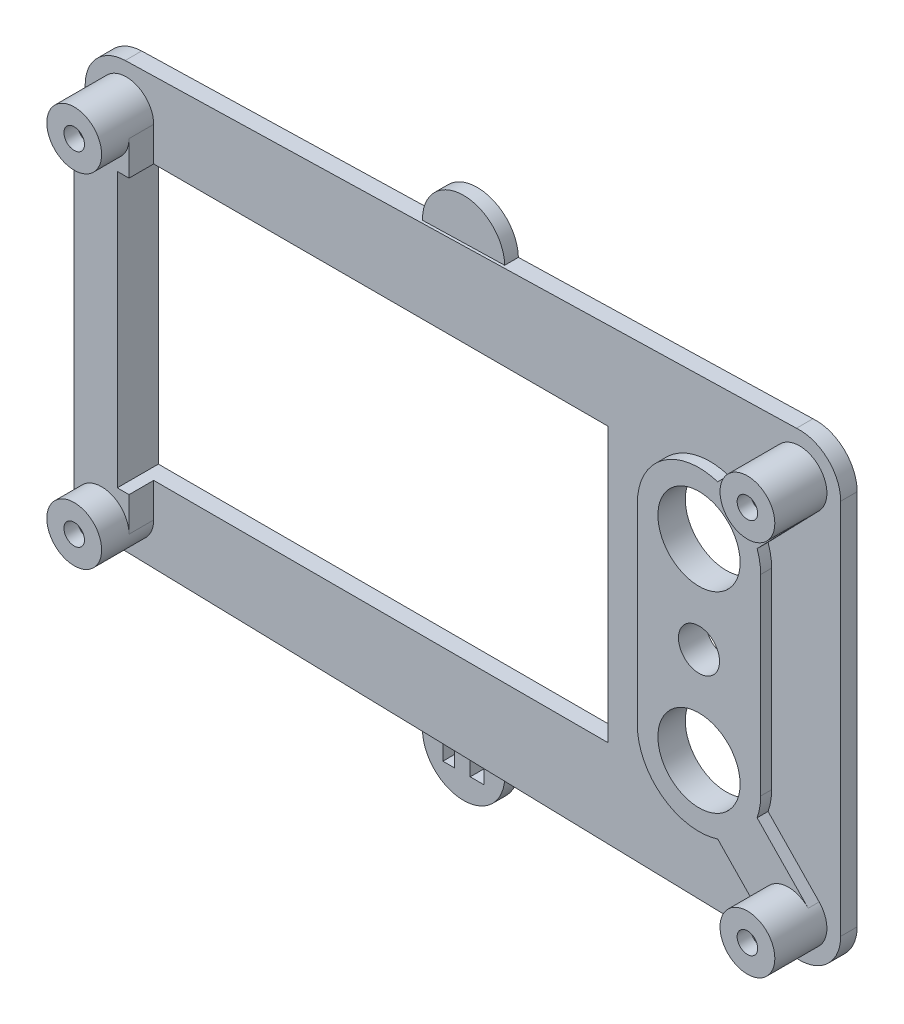
from build123d import *

# Parameters (mm, degrees)
EXTRUDE_1_DEPTH     = 1.2
SKETCH_2_8_R        = 1.5
EXTRUDE_7_DEPTH     = 2
SKETCH_2_9_R        = 1.5
EXTRUDE_8_DEPTH     = 5
SKETCH_2_10_R       = 1.5
EXTRUDE_9_DEPTH     = 5
SKETCH_2_11_R       = 1.5
EXTRUDE_10_DEPTH    = 5
SKETCH_2_12_R       = 1.5
EXTRUDE_11_DEPTH    = 5
SKETCH_2_13_R       = 1.5
SKETCH_2_13_R_2     = 0.75
EXTRUDE_12_DEPTH    = 5
SKETCH_2_14_R       = 1.5
SKETCH_2_14_R_2     = 0.75
EXTRUDE_13_DEPTH    = 5
SKETCH_2_15_R       = 1.5
SKETCH_2_15_R_2     = 0.75
EXTRUDE_14_DEPTH    = 5
SKETCH_2_16_R       = 1.5
SKETCH_2_16_R_2     = 0.75
EXTRUDE_15_DEPTH    = 5
SKETCH_2_19_R       = 1.5
SKETCH_2_19_R_2     = 0.75
CUT_EXTRUDE_4_DEPTH = 4
SKETCH_2_20_R       = 1.5
SKETCH_2_20_R_2     = 0.75
CUT_EXTRUDE_5_DEPTH = 4
SKETCH_2_21_R       = 1.5
SKETCH_2_21_R_2     = 0.75
CUT_EXTRUDE_6_DEPTH = 4
SKETCH_2_22_R       = 1.5
SKETCH_2_22_R_2     = 0.75
CUT_EXTRUDE_7_DEPTH = 4
EXTRUDE_16_DEPTH    = 3
EXTRUDE_18_DEPTH    = 2
EXTRUDE_19_DEPTH    = 1
SKETCH_5_W          = 0.85413001
SKETCH_5_H          = 2.598019217
SKETCH_5_W_2        = 1.005417368
SKETCH_5_H_2        = 2.475260341
CUT_EXTRUDE_9_DEPTH = 1


with BuildPart() as part:
    # 草图2 → 凸台-拉伸1 (new body)
    with BuildSketch(Plane.XY):
        with BuildLine():
            Line((-0.220057138, 2.999023685), (-49.204110666, 1.749023685))
            ThreePointArc((-49.204110666, 1.749023685), (-51.275787659, 0.844087888), (-52.127580054, -1.25))
            Line((-52.127580054, -1.25), (-52.127580054, -26.25))
            ThreePointArc((-52.127580054, -26.25), (-51.275787659, -28.344087888), (-49.204110666, -29.249023685))
            Line((-49.204110666, -29.249023685), (-0.220057138, -30.499023685))
            ThreePointArc((-0.220057138, -30.499023685), (2.04705122, -29.702759522), (3.007086332, -27.5))
            Line((3.007086332, -27.5), (3.007086332, 0))
            ThreePointArc((3.007086332, 0), (2.04705122, 2.202759522), (-0.220057138, 2.999023685))
        make_face()
        with BuildLine():
            ThreePointArc((2, -27.5), (0.750249731, -29.353948581), (-1.437125342, -28.890924423))
            Line((-1.437125342, -28.890924423), (-5.166627539, -25.037543154))
            ThreePointArc((-5.166627539, -25.037543154), (-9.188308261, -24.383089324), (-11.033, -20.75))
            Line((-11.033, -20.75), (-11.033, -6.75))
            ThreePointArc((-11.033, -6.75), (-9.188308261, -3.116910676), (-5.166627539, -2.462456846))
            Line((-5.166627539, -2.462456846), (-1.437125342, 1.390924423))
            ThreePointArc((-1.437125342, 1.390924423), (0.750249731, 1.853948581), (2, 0))
            ThreePointArc((2, 0), (1.853948581, -0.750249731), (1.437125342, -1.390924423))
            Line((1.437125342, -1.390924423), (-2.292376856, -5.244305693))
            ThreePointArc((-2.292376856, -5.244305693), (-2.098318267, -5.986064188), (-2.033, -6.75))
            Line((-2.033, -6.75), (-2.033, -20.75))
            ThreePointArc((-2.033, -20.75), (-2.098318267, -21.513935812), (-2.292376856, -22.255694307))
            Line((-2.292376856, -22.255694307), (1.437125342, -26.109075577))
            ThreePointArc((1.437125342, -26.109075577), (1.853948581, -26.749750269), (2, -27.5))
        make_face(mode=Mode.SUBTRACT)
        with BuildLine():
            ThreePointArc((-47.127580054, -26.25), (-49.127580054, -28.25), (-51.127580054, -26.25))
            Line((-51.127580054, -26.25), (-51.127580054, -1.25))
            ThreePointArc((-51.127580054, -1.25), (-49.127580054, 0.75), (-47.127580054, -1.25))
            Line((-47.127580054, -1.25), (-47.127580054, -3.75))
            Line((-47.127580054, -3.75), (-13.984053528, -3.75))
            Line((-13.984053528, -3.75), (-13.984053528, -13.75))
            Line((-13.984053528, -13.75), (-13.984053528, -23.75))
            Line((-13.984053528, -23.75), (-47.127580054, -23.75))
            Line((-47.127580054, -23.75), (-47.127580054, -26.25))
        make_face(mode=Mode.SUBTRACT)
    extrude(amount=EXTRUDE_1_DEPTH)

    # 草图2<8> → 凸台-拉伸7 (add)
    with BuildSketch(Plane.XY):
        with BuildLine():
            ThreePointArc((-11.033, -20.75), (-9.188308261, -24.383089324), (-5.166627539, -25.037543154))
            Line((-5.166627539, -25.037543154), (-6.415024561, -23.747679402))
            ThreePointArc((-6.415024561, -23.747679402), (-8.695628761, -18.670808609), (-3.533, -20.75))
            ThreePointArc((-3.533, -20.75), (-3.534944099, -20.857985255), (-3.540773877, -20.965830555))
            Line((-3.540773877, -20.965830555), (-2.292376856, -22.255694307))
            ThreePointArc((-2.292376856, -22.255694307), (-2.098318267, -21.513935812), (-2.033, -20.75))
            Line((-2.033, -20.75), (-2.033, -6.75))
            ThreePointArc((-2.033, -6.75), (-2.098318267, -5.986064188), (-2.292376856, -5.244305693))
            Line((-2.292376856, -5.244305693), (-3.540773877, -6.534169445))
            ThreePointArc((-3.540773877, -6.534169445), (-3.534944099, -6.642014745), (-3.533, -6.75))
            ThreePointArc((-3.533, -6.75), (-8.695628761, -8.829191391), (-6.415024561, -3.752320598))
            Line((-6.415024561, -3.752320598), (-5.166627539, -2.462456846))
            ThreePointArc((-5.166627539, -2.462456846), (-9.188308261, -3.116910676), (-11.033, -6.75))
            Line((-11.033, -6.75), (-11.033, -20.75))
        make_face()
        with Locations((-6.533, -13.75)):
            Circle(SKETCH_2_8_R, mode=Mode.SUBTRACT)
    extrude(amount=EXTRUDE_7_DEPTH)

    # 草图2<9> → 凸台-拉伸8 (add)
    with BuildSketch(Plane.XY):
        with BuildLine():
            ThreePointArc((-47.127580054, -1.25), (-49.127580054, 0.75), (-51.127580054, -1.25))
            ThreePointArc((-51.127580054, -1.25), (-49.127580054, -3.25), (-47.127580054, -1.25))
        make_face()
        with Locations((-49.127580054, -1.25)):
            Circle(SKETCH_2_9_R, mode=Mode.SUBTRACT)
    extrude(amount=EXTRUDE_8_DEPTH)

    # 草图2<10> → 凸台-拉伸9 (add)
    with BuildSketch(Plane.XY):
        with BuildLine():
            ThreePointArc((1.437125342, -26.109075577), (-1.390924423, -26.062874658), (-1.437125342, -28.890924423))
            ThreePointArc((-1.437125342, -28.890924423), (0.750249731, -29.353948581), (2, -27.5))
            ThreePointArc((2, -27.5), (1.853948581, -26.749750269), (1.437125342, -26.109075577))
        make_face()
        with Locations((0, -27.5)):
            Circle(SKETCH_2_10_R, mode=Mode.SUBTRACT)
    extrude(amount=EXTRUDE_9_DEPTH)

    # 草图2<11> → 凸台-拉伸10 (add)
    with BuildSketch(Plane.XY):
        with BuildLine():
            ThreePointArc((2, 0), (0.750249731, 1.853948581), (-1.437125342, 1.390924423))
            ThreePointArc((-1.437125342, 1.390924423), (-1.390924423, -1.437125342), (1.437125342, -1.390924423))
            ThreePointArc((1.437125342, -1.390924423), (1.853948581, -0.750249731), (2, 0))
        make_face()
        Circle(SKETCH_2_11_R, mode=Mode.SUBTRACT)
    extrude(amount=EXTRUDE_10_DEPTH)

    # 草图2<12> → 凸台-拉伸11 (add)
    with BuildSketch(Plane.XY):
        with BuildLine():
            ThreePointArc((-47.127580054, -26.25), (-49.127580054, -24.25), (-51.127580054, -26.25))
            ThreePointArc((-51.127580054, -26.25), (-49.127580054, -28.25), (-47.127580054, -26.25))
        make_face()
        with Locations((-49.127580054, -26.25)):
            Circle(SKETCH_2_12_R, mode=Mode.SUBTRACT)
    extrude(amount=EXTRUDE_11_DEPTH)

    # 草图2<13> → 凸台-拉伸12 (add)
    with BuildSketch(Plane.XY):
        with Locations((-49.127580054, -1.25)):
            Circle(SKETCH_2_13_R)
        with Locations((-49.127580054, -1.25)):
            Circle(SKETCH_2_13_R_2, mode=Mode.SUBTRACT)
    extrude(amount=EXTRUDE_12_DEPTH)

    # 草图2<14> → 凸台-拉伸13 (add)
    with BuildSketch(Plane.XY):
        with Locations((-49.127580054, -26.25)):
            Circle(SKETCH_2_14_R)
        with Locations((-49.127580054, -26.25)):
            Circle(SKETCH_2_14_R_2, mode=Mode.SUBTRACT)
    extrude(amount=EXTRUDE_13_DEPTH)

    # 草图2<15> → 凸台-拉伸14 (add)
    with BuildSketch(Plane.XY):
        Circle(SKETCH_2_15_R)
        Circle(SKETCH_2_15_R_2, mode=Mode.SUBTRACT)
    extrude(amount=EXTRUDE_14_DEPTH)

    # 草图2<16> → 凸台-拉伸15 (add)
    with BuildSketch(Plane.XY):
        with Locations((0, -27.5)):
            Circle(SKETCH_2_16_R)
        with Locations((0, -27.5)):
            Circle(SKETCH_2_16_R_2, mode=Mode.SUBTRACT)
    extrude(amount=EXTRUDE_15_DEPTH)

    # 草图2<19> → 切除-拉伸4 (cut)
    with BuildSketch(Plane.XY):
        with Locations((-49.127580054, -1.25)):
            Circle(SKETCH_2_19_R)
        with Locations((-49.127580054, -1.25)):
            Circle(SKETCH_2_19_R_2, mode=Mode.SUBTRACT)
    extrude(amount=CUT_EXTRUDE_4_DEPTH, mode=Mode.SUBTRACT)

    # 草图2<20> → 切除-拉伸5 (cut)
    with BuildSketch(Plane.XY):
        with Locations((-49.127580054, -26.25)):
            Circle(SKETCH_2_20_R)
        with Locations((-49.127580054, -26.25)):
            Circle(SKETCH_2_20_R_2, mode=Mode.SUBTRACT)
    extrude(amount=CUT_EXTRUDE_5_DEPTH, mode=Mode.SUBTRACT)

    # 草图2<21> → 切除-拉伸6 (cut)
    with BuildSketch(Plane.XY):
        with Locations((0, -27.5)):
            Circle(SKETCH_2_21_R)
        with Locations((0, -27.5)):
            Circle(SKETCH_2_21_R_2, mode=Mode.SUBTRACT)
    extrude(amount=CUT_EXTRUDE_6_DEPTH, mode=Mode.SUBTRACT)

    # 草图2<22> → 切除-拉伸7 (cut)
    with BuildSketch(Plane.XY):
        Circle(SKETCH_2_22_R)
        Circle(SKETCH_2_22_R_2, mode=Mode.SUBTRACT)
    extrude(amount=CUT_EXTRUDE_7_DEPTH, mode=Mode.SUBTRACT)

    # 草图2<23> → 凸台-拉伸16 (add)
    with BuildSketch(Plane.XY):
        with BuildLine():
            Line((-51.127580054, -1.25), (-51.127580054, -26.25))
            ThreePointArc((-51.127580054, -26.25), (-49.127580054, -24.25), (-47.127580054, -26.25))
            Line((-47.127580054, -26.25), (-47.127580054, -23.75))
            Line((-47.127580054, -23.75), (-47.984053528, -23.75))
            Line((-47.984053528, -23.75), (-47.984053528, -13.75))
            Line((-47.984053528, -13.75), (-47.984053528, -3.75))
            Line((-47.984053528, -3.75), (-47.127580054, -3.75))
            Line((-47.127580054, -3.75), (-47.127580054, -1.25))
            ThreePointArc((-47.127580054, -1.25), (-49.127580054, -3.25), (-51.127580054, -1.25))
        make_face()
    extrude(amount=EXTRUDE_16_DEPTH)

    # 草图2<24> → 凸台-拉伸18 (add)
    with BuildSketch(Plane.XY):
        with BuildLine():
            ThreePointArc((-1.437125342, -28.890924423), (-1.390924423, -26.062874658), (1.437125342, -26.109075577))
            Line((1.437125342, -26.109075577), (-3.540773877, -20.965830555))
            ThreePointArc((-3.540773877, -20.965830555), (-4.446613365, -22.905688013), (-6.415024561, -23.747679402))
            Line((-6.415024561, -23.747679402), (-1.437125342, -28.890924423))
        make_face()
        with BuildLine():
            Line((-3.540773877, -6.534169445), (1.437125342, -1.390924423))
            ThreePointArc((1.437125342, -1.390924423), (-1.390924423, -1.437125342), (-1.437125342, 1.390924423))
            Line((-1.437125342, 1.390924423), (-6.415024561, -3.752320598))
            ThreePointArc((-6.415024561, -3.752320598), (-4.446613365, -4.594311987), (-3.540773877, -6.534169445))
        make_face()
    extrude(amount=EXTRUDE_18_DEPTH)

    # 草图4 → 凸台-拉伸19 (add)
    with BuildSketch(Plane(origin=(0, 0, 0), x_dir=(-1, 0, 0), z_dir=(0, 0, -1))):
        with BuildLine():
            Line((27.712083902, 2.374023685), (27.712083902, -0.625976315))
            ThreePointArc((27.712083902, -0.625976315), (24.712083902, -3.625976315), (21.712083902, -0.625976315))
            Line((21.712083902, -0.625976315), (21.712083902, 2.374023685))
            ThreePointArc((21.712083902, 2.374023685), (24.712083902, 5.374023685), (27.712083902, 2.374023685))
        make_face()
        with BuildLine():
            Line((21.712083902, -29.874023685), (21.712083902, -26.874023685))
            ThreePointArc((21.712083902, -26.874023685), (24.712083902, -23.874023685), (27.712083902, -26.874023685))
            Line((27.712083902, -26.874023685), (27.712083902, -29.874023685))
            ThreePointArc((27.712083902, -29.874023685), (24.712083902, -32.874023685), (21.712083902, -29.874023685))
        make_face()
    extrude(amount=-EXTRUDE_19_DEPTH)

    # 草图5 → 切除-拉伸9 (cut)
    with BuildSketch(Plane.XY.offset(1)):
        with Locations((-25.795795215, -29.846368989)):
            Rectangle(SKETCH_5_W, SKETCH_5_H)
        with Locations((-23.726763116, -29.899167603)):
            Rectangle(SKETCH_5_W_2, SKETCH_5_H_2)
    extrude(amount=-CUT_EXTRUDE_9_DEPTH, mode=Mode.SUBTRACT)


solid = part.part
